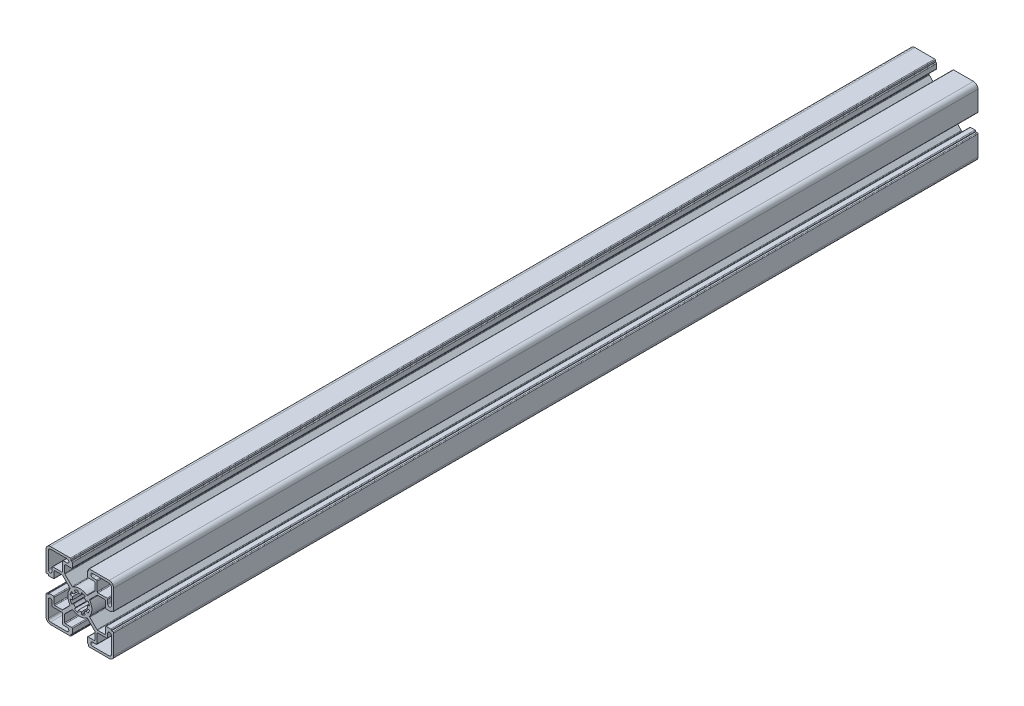
from build123d import *

# Parameters (mm, degrees)
BOSS_EXTRUDE1_DEPTH      = 152.4
BOSS_EXTRUDE1_DEPTH_BACK = 152.4
SKETCH3_R                = 5
FILLET1_R                = 0.5
CUT_EXTRUDE1_DEPTH       = 307.456424309
BOSS_EXTRUDE2_DEPTH      = 270.275


with BuildPart() as part:
    # Sketch3 → Boss-Extrude1 (new, two sides: drawn at the far end of the back side and taken through both)
    with BuildSketch(Plane.XY.offset(-BOSS_EXTRUDE1_DEPTH_BACK)):
        with BuildLine():
            Line((-11.55, -10.05), (-6.356915373, -4.856915373))
            ThreePointArc((-6.356915373, -4.856915373), (-8, 0), (-6.356915373, 4.856915373))
            Line((-6.356915373, 4.856915373), (-11.55, 10.05))
            Line((-11.55, 10.05), (-17.025, 10.05))
            Line((-17.025, 10.05), (-17.025, 5))
            Line((-17.025, 5), (-21, 5))
            Line((-21, 5), (-21, 5.8))
            Line((-21, 5.8), (-22.5, 5.8))
            Line((-22.5, 5.8), (-22.5, 19.5))
            ThreePointArc((-22.5, 19.5), (-21.621320344, 21.621320344), (-19.5, 22.5))
            Line((-19.5, 22.5), (-5.8, 22.5))
            Line((-5.8, 22.5), (-5.8, 21))
            Line((-5.8, 21), (-5, 21))
            Line((-5, 21), (-5, 17.025))
            Line((-5, 17.025), (-10.05, 17.025))
            Line((-10.05, 17.025), (-10.05, 11.55))
            Line((-10.05, 11.55), (-4.856915373, 6.356915373))
            ThreePointArc((-4.856915373, 6.356915373), (0, 8), (4.856915373, 6.356915373))
            Line((4.856915373, 6.356915373), (10.05, 11.55))
            Line((10.05, 11.55), (10.05, 17.025))
            Line((10.05, 17.025), (5, 17.025))
            Line((5, 17.025), (5, 21))
            Line((5, 21), (5.8, 21))
            Line((5.8, 21), (5.8, 22.5))
            Line((5.8, 22.5), (19.5, 22.5))
            ThreePointArc((19.5, 22.5), (21.621320344, 21.621320344), (22.5, 19.5))
            Line((22.5, 19.5), (22.5, 5.8))
            Line((22.5, 5.8), (21, 5.8))
            Line((21, 5.8), (21, 5))
            Line((21, 5), (17.025, 5))
            Line((17.025, 5), (17.025, 10.05))
            Line((17.025, 10.05), (11.55, 10.05))
            Line((11.55, 10.05), (6.356915373, 4.856915373))
            ThreePointArc((6.356915373, 4.856915373), (8, 0), (6.356915373, -4.856915373))
            Line((6.356915373, -4.856915373), (11.55, -10.05))
            Line((11.55, -10.05), (17.025, -10.05))
            Line((17.025, -10.05), (17.025, -5))
            Line((17.025, -5), (21, -5))
            Line((21, -5), (21, -5.8))
            Line((21, -5.8), (22.5, -5.8))
            Line((22.5, -5.8), (22.5, -19.5))
            ThreePointArc((22.5, -19.5), (21.621320344, -21.621320344), (19.5, -22.5))
            Line((19.5, -22.5), (5.8, -22.5))
            Line((5.8, -22.5), (5.8, -21))
            Line((5.8, -21), (5, -21))
            Line((5, -21), (5, -17.025))
            Line((5, -17.025), (10.05, -17.025))
            Line((10.05, -17.025), (10.05, -11.55))
            Line((10.05, -11.55), (4.856915373, -6.356915373))
            ThreePointArc((4.856915373, -6.356915373), (0, -8), (-4.856915373, -6.356915373))
            Line((-4.856915373, -6.356915373), (-10.05, -11.55))
            Line((-10.05, -11.55), (-10.05, -17.025))
            Line((-10.05, -17.025), (-5, -17.025))
            Line((-5, -17.025), (-5, -21))
            Line((-5, -21), (-5.8, -21))
            Line((-5.8, -21), (-5.8, -22.5))
            Line((-5.8, -22.5), (-19.5, -22.5))
            ThreePointArc((-19.5, -22.5), (-21.621320344, -21.621320344), (-22.5, -19.5))
            Line((-22.5, -19.5), (-22.5, -5.8))
            Line((-22.5, -5.8), (-21, -5.8))
            Line((-21, -5.8), (-21, -5))
            Line((-21, -5), (-17.025, -5))
            Line((-17.025, -5), (-17.025, -10.05))
            Line((-17.025, -10.05), (-11.55, -10.05))
        make_face()
        with Locations(Location((0, 0, 0), (0, 0, 180))):
            Circle(SKETCH3_R, mode=Mode.SUBTRACT)
        with BuildLine():
            Line((-21, 8.5375), (-21, 19.5))
            ThreePointArc((-21, 19.5), (-20.560660172, 20.560660172), (-19.5, 21))
            Line((-19.5, 21), (-8.5375, 21))
            ThreePointArc((-8.5375, 21), (-7.3, 19.7625), (-8.5375, 18.525))
            Line((-8.5375, 18.525), (-11.55, 18.525))
            Line((-11.55, 18.525), (-11.55, 11.55))
            Line((-11.55, 11.55), (-18.525, 11.55))
            Line((-18.525, 11.55), (-18.525, 8.5375))
            ThreePointArc((-18.525, 8.5375), (-19.7625, 7.3), (-21, 8.5375))
        make_face(mode=Mode.SUBTRACT)
        with BuildLine():
            Line((8.5375, 21), (19.5, 21))
            ThreePointArc((19.5, 21), (20.560660172, 20.560660172), (21, 19.5))
            Line((21, 19.5), (21, 8.5375))
            ThreePointArc((21, 8.5375), (19.7625, 7.3), (18.525, 8.5375))
            Line((18.525, 8.5375), (18.525, 11.55))
            Line((18.525, 11.55), (11.55, 11.55))
            Line((11.55, 11.55), (11.55, 18.525))
            Line((11.55, 18.525), (8.5375, 18.525))
            ThreePointArc((8.5375, 18.525), (7.3, 19.7625), (8.5375, 21))
        make_face(mode=Mode.SUBTRACT)
        with BuildLine():
            Line((21, -8.5375), (21, -19.5))
            ThreePointArc((21, -19.5), (20.560660172, -20.560660172), (19.5, -21))
            Line((19.5, -21), (8.5375, -21))
            ThreePointArc((8.5375, -21), (7.3, -19.7625), (8.5375, -18.525))
            Line((8.5375, -18.525), (11.55, -18.525))
            Line((11.55, -18.525), (11.55, -11.55))
            Line((11.55, -11.55), (18.525, -11.55))
            Line((18.525, -11.55), (18.525, -8.5375))
            ThreePointArc((18.525, -8.5375), (19.7625, -7.3), (21, -8.5375))
        make_face(mode=Mode.SUBTRACT)
        with BuildLine():
            Line((-8.5375, -21), (-19.5, -21))
            ThreePointArc((-19.5, -21), (-20.560660172, -20.560660172), (-21, -19.5))
            Line((-21, -19.5), (-21, -8.5375))
            ThreePointArc((-21, -8.5375), (-19.7625, -7.3), (-18.525, -8.5375))
            Line((-18.525, -8.5375), (-18.525, -11.55))
            Line((-18.525, -11.55), (-11.55, -11.55))
            Line((-11.55, -11.55), (-11.55, -18.525))
            Line((-11.55, -18.525), (-8.5375, -18.525))
            ThreePointArc((-8.5375, -18.525), (-7.3, -19.7625), (-8.5375, -21))
        make_face(mode=Mode.SUBTRACT)
    extrude(amount=BOSS_EXTRUDE1_DEPTH + BOSS_EXTRUDE1_DEPTH_BACK)

    # Fillet1
    fillet1_edges = [part.edges().sort_by_distance(p)[0] for p in [
        (-11.55, -18.525, 0),
        (-11.55, -11.55, 0),
        (18.525, -11.55, 0),
        (11.55, -11.55, 0),
        (11.55, -18.525, 0),
        (11.55, 18.525, 0),
        (11.55, 11.55, 0),
        (18.525, 11.55, 0),
        (-18.525, 11.55, 0),
        (-11.55, 11.55, 0),
        (-11.55, 18.525, 0),
        (6.356915373, -4.856915373, 0),
        (11.55, -10.05, 0),
        (17.025, -10.05, 0),
        (17.025, -5, 0),
        (21, -5, 0),
        (22.5, -5.8, 0),
        (5.8, -22.5, 0),
        (5, -21, 0),
        (5, -17.025, 0),
        (10.05, -17.025, 0),
        (10.05, -11.55, 0),
        (4.856915373, -6.356915373, 0),
        (-4.856915373, -6.356915373, 0),
        (-10.05, -11.55, 0),
        (-10.05, -17.025, 0),
        (-5, -17.025, 0),
        (-5, -21, 0),
        (-5.8, -22.5, 0),
        (-22.5, -5.8, 0),
        (-21, -5, 0),
        (-17.025, -5, 0),
        (-17.025, -10.05, 0),
        (-11.55, -10.05, 0),
        (-6.356915373, -4.856915373, 0),
        (-6.356915373, 4.856915373, 0),
        (-11.55, 10.05, 0),
        (-17.025, 10.05, 0),
        (-17.025, 5, 0),
        (-21, 5, 0),
        (-22.5, 5.8, 0),
        (-5.8, 22.5, 0),
        (-5, 21, 0),
        (-5, 17.025, 0),
        (-10.05, 17.025, 0),
        (-10.05, 11.55, 0),
        (-4.856915373, 6.356915373, 0),
        (4.856915373, 6.356915373, 0),
        (10.05, 11.55, 0),
        (10.05, 17.025, 0),
        (5, 17.025, 0),
        (5, 21, 0),
        (5.8, 22.5, 0),
        (22.5, 5.8, 0),
        (21, 5, 0),
        (17.025, 5, 0),
        (11.55, 10.05, 0),
        (6.356915373, 4.856915373, 0),
    ]]
    fillet(fillet1_edges, radius=FILLET1_R)

    # Sketch4 → Cut-Extrude1 (cut, through all)
    with BuildSketch(Plane.XY.offset(152.4)):
        with BuildLine():
            Line((-1.268087093, 6.375104323), (-0.97545161, 4.903926402))
            ThreePointArc((-0.97545161, 4.903926402), (-1.913417162, 4.619397663), (-2.777851165, 4.157348062))
            Line((-2.777851165, 4.157348062), (-3.611206515, 5.40455248))
            ThreePointArc((-3.611206515, 5.40455248), (-2.48744231, 6.005216961), (-1.268087093, 6.375104323))
        make_face()
        with BuildLine():
            Line((1.268087093, 6.375104323), (0.97545161, 4.903926402))
            ThreePointArc((0.97545161, 4.903926402), (1.913417162, 4.619397663), (2.777851165, 4.157348062))
            Line((2.777851165, 4.157348062), (3.611206515, 5.40455248))
            ThreePointArc((3.611206515, 5.40455248), (2.48744231, 6.005216961), (1.268087093, 6.375104323))
        make_face()
        with BuildLine():
            Line((5.40455248, 3.611206515), (4.157348062, 2.777851165))
            ThreePointArc((4.157348062, 2.777851165), (4.619397663, 1.913417162), (4.903926402, 0.97545161))
            Line((4.903926402, 0.97545161), (6.375104323, 1.268087093))
            ThreePointArc((6.375104323, 1.268087093), (6.005216961, 2.48744231), (5.40455248, 3.611206515))
        make_face()
        with BuildLine():
            Line((6.375104323, -1.268087093), (4.903926402, -0.97545161))
            ThreePointArc((4.903926402, -0.97545161), (4.619397663, -1.913417162), (4.157348062, -2.777851165))
            Line((4.157348062, -2.777851165), (5.40455248, -3.611206515))
            ThreePointArc((5.40455248, -3.611206515), (6.005216961, -2.48744231), (6.375104323, -1.268087093))
        make_face()
        with BuildLine():
            Line((3.611206515, -5.40455248), (2.777851165, -4.157348062))
            ThreePointArc((2.777851165, -4.157348062), (1.913417162, -4.619397663), (0.97545161, -4.903926402))
            Line((0.97545161, -4.903926402), (1.268087093, -6.375104323))
            ThreePointArc((1.268087093, -6.375104323), (2.48744231, -6.005216961), (3.611206515, -5.40455248))
        make_face()
        with BuildLine():
            Line((-1.268087093, -6.375104323), (-0.97545161, -4.903926402))
            ThreePointArc((-0.97545161, -4.903926402), (-1.913417162, -4.619397663), (-2.777851165, -4.157348062))
            Line((-2.777851165, -4.157348062), (-3.611206515, -5.40455248))
            ThreePointArc((-3.611206515, -5.40455248), (-2.48744231, -6.005216961), (-1.268087093, -6.375104323))
        make_face()
        with BuildLine():
            Line((-5.40455248, -3.611206515), (-4.157348062, -2.777851165))
            ThreePointArc((-4.157348062, -2.777851165), (-4.619397663, -1.913417162), (-4.903926402, -0.97545161))
            Line((-4.903926402, -0.97545161), (-6.375104323, -1.268087093))
            ThreePointArc((-6.375104323, -1.268087093), (-6.005216961, -2.48744231), (-5.40455248, -3.611206515))
        make_face()
        with BuildLine():
            Line((-6.375104323, 1.268087093), (-4.903926402, 0.97545161))
            ThreePointArc((-4.903926402, 0.97545161), (-4.619397663, 1.913417162), (-4.157348062, 2.777851165))
            Line((-4.157348062, 2.777851165), (-5.40455248, 3.611206515))
            ThreePointArc((-5.40455248, 3.611206515), (-6.005216961, 2.48744231), (-6.375104323, 1.268087093))
        make_face()
    extrude(amount=-CUT_EXTRUDE1_DEPTH, mode=Mode.SUBTRACT)

    # Sketch5 → Boss-Extrude2 (add)
    with BuildSketch(Plane.XY.offset(152.4)):
        with BuildLine():
            Line((22.5, -19.5), (22.5, -6.3))
            ThreePointArc((22.5, -6.3), (22.353553391, -5.946446609), (22, -5.8))
            Line((22, -5.8), (21, -5.8))
            Line((21, -5.8), (21, -5.5))
            ThreePointArc((21, -5.5), (20.853553391, -5.146446609), (20.5, -5))
            Line((20.5, -5), (17.525, -5))
            ThreePointArc((17.525, -5), (17.171446609, -5.146446609), (17.025, -5.5))
            Line((17.025, -5.5), (17.025, -9.55))
            ThreePointArc((17.025, -9.55), (16.878553391, -9.903553391), (16.525, -10.05))
            Line((16.525, -10.05), (11.757106781, -10.05))
            ThreePointArc((11.757106781, -10.05), (11.565765065, -10.011939766), (11.403553391, -9.903553391))
            Line((11.403553391, -9.903553391), (6.658229, -5.158229))
            ThreePointArc((6.658229, -5.158229), (6.513911961, -4.850773717), (6.599324603, -4.522047632))
            ThreePointArc((6.599324603, -4.522047632), (8, 0), (6.599324603, 4.522047632))
            ThreePointArc((6.599324603, 4.522047632), (6.513911961, 4.850773717), (6.658229, 5.158229))
            Line((6.658229, 5.158229), (11.403553391, 9.903553391))
            ThreePointArc((11.403553391, 9.903553391), (11.565765065, 10.011939766), (11.757106781, 10.05))
            Line((11.757106781, 10.05), (17.025, 10.05))
            Line((17.025, 10.05), (17.025, 5.5))
            ThreePointArc((17.025, 5.5), (17.171446609, 5.146446609), (17.525, 5))
            Line((17.525, 5), (20.5, 5))
            ThreePointArc((20.5, 5), (20.853553391, 5.146446609), (21, 5.5))
            Line((21, 5.5), (21, 5.8))
            Line((21, 5.8), (22, 5.8))
            ThreePointArc((22, 5.8), (22.353553391, 5.946446609), (22.5, 6.3))
            Line((22.5, 6.3), (22.5, 19.5))
            ThreePointArc((22.5, 19.5), (21.621320344, 21.621320344), (19.5, 22.5))
            Line((19.5, 22.5), (6.3, 22.5))
            ThreePointArc((6.3, 22.5), (5.946446609, 22.353553391), (5.8, 22))
            Line((5.8, 22), (5.8, 21))
            Line((5.8, 21), (5.5, 21))
            ThreePointArc((5.5, 21), (5.146446609, 20.853553391), (5, 20.5))
            Line((5, 20.5), (5, 17.525))
            ThreePointArc((5, 17.525), (5.146446609, 17.171446609), (5.5, 17.025))
            Line((5.5, 17.025), (9.55, 17.025))
            ThreePointArc((9.55, 17.025), (9.903553391, 16.878553391), (10.05, 16.525))
            Line((10.05, 16.525), (10.05, 11.757106781))
            ThreePointArc((10.05, 11.757106781), (10.011939766, 11.565765065), (9.903553391, 11.403553391))
            Line((9.903553391, 11.403553391), (5.158229, 6.658229))
            ThreePointArc((5.158229, 6.658229), (4.850773717, 6.513911961), (4.522047632, 6.599324603))
            ThreePointArc((4.522047632, 6.599324603), (0, 8), (-4.522047632, 6.599324603))
            ThreePointArc((-4.522047632, 6.599324603), (-4.850773717, 6.513911961), (-5.158229, 6.658229))
            Line((-5.158229, 6.658229), (-9.903553391, 11.403553391))
            ThreePointArc((-9.903553391, 11.403553391), (-10.011939766, 11.565765065), (-10.05, 11.757106781))
            Line((-10.05, 11.757106781), (-10.05, 16.525))
            ThreePointArc((-10.05, 16.525), (-9.903553391, 16.878553391), (-9.55, 17.025))
            Line((-9.55, 17.025), (-5.5, 17.025))
            ThreePointArc((-5.5, 17.025), (-5.146446609, 17.171446609), (-5, 17.525))
            Line((-5, 17.525), (-5, 20.5))
            ThreePointArc((-5, 20.5), (-5.146446609, 20.853553391), (-5.5, 21))
            Line((-5.5, 21), (-5.8, 21))
            Line((-5.8, 21), (-5.8, 22))
            ThreePointArc((-5.8, 22), (-5.946446609, 22.353553391), (-6.3, 22.5))
            Line((-6.3, 22.5), (-19.5, 22.5))
            ThreePointArc((-19.5, 22.5), (-21.621320344, 21.621320344), (-22.5, 19.5))
            Line((-22.5, 19.5), (-22.5, 6.3))
            ThreePointArc((-22.5, 6.3), (-22.353553391, 5.946446609), (-22, 5.8))
            Line((-22, 5.8), (-21, 5.8))
            Line((-21, 5.8), (-21, 5.5))
            ThreePointArc((-21, 5.5), (-20.853553391, 5.146446609), (-20.5, 5))
            Line((-20.5, 5), (-17.525, 5))
            ThreePointArc((-17.525, 5), (-17.171446609, 5.146446609), (-17.025, 5.5))
            Line((-17.025, 5.5), (-17.025, 9.55))
            ThreePointArc((-17.025, 9.55), (-16.878553391, 9.903553391), (-16.525, 10.05))
            Line((-16.525, 10.05), (-11.757106781, 10.05))
            ThreePointArc((-11.757106781, 10.05), (-11.565765065, 10.011939766), (-11.403553391, 9.903553391))
            Line((-11.403553391, 9.903553391), (-6.658229, 5.158229))
            ThreePointArc((-6.658229, 5.158229), (-6.513911961, 4.850773717), (-6.599324603, 4.522047632))
            ThreePointArc((-6.599324603, 4.522047632), (-8, 0), (-6.599324603, -4.522047632))
            ThreePointArc((-6.599324603, -4.522047632), (-6.513911961, -4.850773717), (-6.658229, -5.158229))
            Line((-6.658229, -5.158229), (-11.403553391, -9.903553391))
            ThreePointArc((-11.403553391, -9.903553391), (-11.565765065, -10.011939766), (-11.757106781, -10.05))
            Line((-11.757106781, -10.05), (-16.525, -10.05))
            ThreePointArc((-16.525, -10.05), (-16.878553391, -9.903553391), (-17.025, -9.55))
            Line((-17.025, -9.55), (-17.025, -5.5))
            ThreePointArc((-17.025, -5.5), (-17.171446609, -5.146446609), (-17.525, -5))
            Line((-17.525, -5), (-20.5, -5))
            ThreePointArc((-20.5, -5), (-20.853553391, -5.146446609), (-21, -5.5))
            Line((-21, -5.5), (-21, -5.8))
            Line((-21, -5.8), (-22, -5.8))
            ThreePointArc((-22, -5.8), (-22.353553391, -5.946446609), (-22.5, -6.3))
            Line((-22.5, -6.3), (-22.5, -19.5))
            ThreePointArc((-22.5, -19.5), (-21.621320344, -21.621320344), (-19.5, -22.5))
            Line((-19.5, -22.5), (-6.3, -22.5))
            ThreePointArc((-6.3, -22.5), (-5.946446609, -22.353553391), (-5.8, -22))
            Line((-5.8, -22), (-5.8, -21))
            Line((-5.8, -21), (-5.5, -21))
            ThreePointArc((-5.5, -21), (-5.146446609, -20.853553391), (-5, -20.5))
            Line((-5, -20.5), (-5, -17.525))
            ThreePointArc((-5, -17.525), (-5.146446609, -17.171446609), (-5.5, -17.025))
            Line((-5.5, -17.025), (-9.55, -17.025))
            ThreePointArc((-9.55, -17.025), (-9.903553391, -16.878553391), (-10.05, -16.525))
            Line((-10.05, -16.525), (-10.05, -11.757106781))
            ThreePointArc((-10.05, -11.757106781), (-10.011939766, -11.565765065), (-9.903553391, -11.403553391))
            Line((-9.903553391, -11.403553391), (-5.158229, -6.658229))
            ThreePointArc((-5.158229, -6.658229), (-4.850773717, -6.513911961), (-4.522047632, -6.599324603))
            ThreePointArc((-4.522047632, -6.599324603), (0, -8), (4.522047632, -6.599324603))
            ThreePointArc((4.522047632, -6.599324603), (4.850773717, -6.513911961), (5.158229, -6.658229))
            Line((5.158229, -6.658229), (9.903553391, -11.403553391))
            ThreePointArc((9.903553391, -11.403553391), (10.011939766, -11.565765065), (10.05, -11.757106781))
            Line((10.05, -11.757106781), (10.05, -16.525))
            ThreePointArc((10.05, -16.525), (9.903553391, -16.878553391), (9.55, -17.025))
            Line((9.55, -17.025), (5.5, -17.025))
            ThreePointArc((5.5, -17.025), (5.146446609, -17.171446609), (5, -17.525))
            Line((5, -17.525), (5, -20.5))
            ThreePointArc((5, -20.5), (5.146446609, -20.853553391), (5.5, -21))
            Line((5.5, -21), (5.8, -21))
            Line((5.8, -21), (5.8, -22))
            ThreePointArc((5.8, -22), (5.946446609, -22.353553391), (6.3, -22.5))
            Line((6.3, -22.5), (19.5, -22.5))
            ThreePointArc((19.5, -22.5), (21.621320344, -21.621320344), (22.5, -19.5))
        make_face()
        with BuildLine():
            Line((-11.55, -18.025), (-11.55, -12.05))
            ThreePointArc((-11.55, -12.05), (-11.696446609, -11.696446609), (-12.05, -11.55))
            Line((-12.05, -11.55), (-18.525, -11.55))
            Line((-18.525, -11.55), (-18.525, -8.5375))
            ThreePointArc((-18.525, -8.5375), (-19.7625, -7.3), (-21, -8.5375))
            Line((-21, -8.5375), (-21, -19.5))
            ThreePointArc((-21, -19.5), (-20.560660172, -20.560660172), (-19.5, -21))
            Line((-19.5, -21), (-8.5375, -21))
            ThreePointArc((-8.5375, -21), (-7.3, -19.7625), (-8.5375, -18.525))
            Line((-8.5375, -18.525), (-11.05, -18.525))
            ThreePointArc((-11.05, -18.525), (-11.403553391, -18.378553391), (-11.55, -18.025))
        make_face(mode=Mode.SUBTRACT)
        with BuildLine():
            Line((-0.97545161, 4.903926402), (-1.268087093, 6.375104323))
            ThreePointArc((-1.268087093, 6.375104323), (-2.48744231, 6.005216961), (-3.611206515, 5.40455248))
            Line((-3.611206515, 5.40455248), (-2.777851165, 4.157348062))
            ThreePointArc((-2.777851165, 4.157348062), (-3.535533906, 3.535533906), (-4.157348062, 2.777851165))
            Line((-4.157348062, 2.777851165), (-5.40455248, 3.611206515))
            ThreePointArc((-5.40455248, 3.611206515), (-6.005216961, 2.48744231), (-6.375104323, 1.268087093))
            Line((-6.375104323, 1.268087093), (-4.903926402, 0.97545161))
            ThreePointArc((-4.903926402, 0.97545161), (-5, 0), (-4.903926402, -0.97545161))
            Line((-4.903926402, -0.97545161), (-6.375104323, -1.268087093))
            ThreePointArc((-6.375104323, -1.268087093), (-6.005216961, -2.48744231), (-5.40455248, -3.611206515))
            Line((-5.40455248, -3.611206515), (-4.157348062, -2.777851165))
            ThreePointArc((-4.157348062, -2.777851165), (-3.535533906, -3.535533906), (-2.777851165, -4.157348062))
            Line((-2.777851165, -4.157348062), (-3.611206515, -5.40455248))
            ThreePointArc((-3.611206515, -5.40455248), (-2.48744231, -6.005216961), (-1.268087093, -6.375104323))
            Line((-1.268087093, -6.375104323), (-0.97545161, -4.903926402))
            ThreePointArc((-0.97545161, -4.903926402), (0, -5), (0.97545161, -4.903926402))
            Line((0.97545161, -4.903926402), (1.268087093, -6.375104323))
            ThreePointArc((1.268087093, -6.375104323), (2.48744231, -6.005216961), (3.611206515, -5.40455248))
            Line((3.611206515, -5.40455248), (2.777851165, -4.157348062))
            ThreePointArc((2.777851165, -4.157348062), (3.535533906, -3.535533906), (4.157348062, -2.777851165))
            Line((4.157348062, -2.777851165), (5.40455248, -3.611206515))
            ThreePointArc((5.40455248, -3.611206515), (6.005216961, -2.48744231), (6.375104323, -1.268087093))
            Line((6.375104323, -1.268087093), (4.903926402, -0.97545161))
            ThreePointArc((4.903926402, -0.97545161), (5, 0), (4.903926402, 0.97545161))
            Line((4.903926402, 0.97545161), (6.375104323, 1.268087093))
            ThreePointArc((6.375104323, 1.268087093), (6.005216961, 2.48744231), (5.40455248, 3.611206515))
            Line((5.40455248, 3.611206515), (4.157348062, 2.777851165))
            ThreePointArc((4.157348062, 2.777851165), (3.535533906, 3.535533906), (2.777851165, 4.157348062))
            Line((2.777851165, 4.157348062), (3.611206515, 5.40455248))
            ThreePointArc((3.611206515, 5.40455248), (2.48744231, 6.005216961), (1.268087093, 6.375104323))
            Line((1.268087093, 6.375104323), (0.97545161, 4.903926402))
            ThreePointArc((0.97545161, 4.903926402), (0, 5), (-0.97545161, 4.903926402))
        make_face(mode=Mode.SUBTRACT)
        with BuildLine():
            Line((18.025, -11.55), (12.05, -11.55))
            ThreePointArc((12.05, -11.55), (11.696446609, -11.696446609), (11.55, -12.05))
            Line((11.55, -12.05), (11.55, -18.025))
            ThreePointArc((11.55, -18.025), (11.403553391, -18.378553391), (11.05, -18.525))
            Line((11.05, -18.525), (8.5375, -18.525))
            ThreePointArc((8.5375, -18.525), (7.3, -19.7625), (8.5375, -21))
            Line((8.5375, -21), (19.5, -21))
            ThreePointArc((19.5, -21), (20.560660172, -20.560660172), (21, -19.5))
            Line((21, -19.5), (21, -8.5375))
            ThreePointArc((21, -8.5375), (19.7625, -7.3), (18.525, -8.5375))
            Line((18.525, -8.5375), (18.525, -11.05))
            ThreePointArc((18.525, -11.05), (18.378553391, -11.403553391), (18.025, -11.55))
        make_face(mode=Mode.SUBTRACT)
        with BuildLine():
            Line((11.55, 18.025), (11.55, 12.05))
            ThreePointArc((11.55, 12.05), (11.696446609, 11.696446609), (12.05, 11.55))
            Line((12.05, 11.55), (18.025, 11.55))
            ThreePointArc((18.025, 11.55), (18.378553391, 11.403553391), (18.525, 11.05))
            Line((18.525, 11.05), (18.525, 8.5375))
            ThreePointArc((18.525, 8.5375), (19.7625, 7.3), (21, 8.5375))
            Line((21, 8.5375), (21, 19.5))
            ThreePointArc((21, 19.5), (20.560660172, 20.560660172), (19.5, 21))
            Line((19.5, 21), (8.5375, 21))
            ThreePointArc((8.5375, 21), (7.3, 19.7625), (8.5375, 18.525))
            Line((8.5375, 18.525), (11.05, 18.525))
            ThreePointArc((11.05, 18.525), (11.403553391, 18.378553391), (11.55, 18.025))
        make_face(mode=Mode.SUBTRACT)
        with BuildLine():
            Line((-18.025, 11.55), (-12.05, 11.55))
            ThreePointArc((-12.05, 11.55), (-11.696446609, 11.696446609), (-11.55, 12.05))
            Line((-11.55, 12.05), (-11.55, 18.025))
            ThreePointArc((-11.55, 18.025), (-11.403553391, 18.378553391), (-11.05, 18.525))
            Line((-11.05, 18.525), (-8.5375, 18.525))
            ThreePointArc((-8.5375, 18.525), (-7.3, 19.7625), (-8.5375, 21))
            Line((-8.5375, 21), (-19.5, 21))
            ThreePointArc((-19.5, 21), (-20.560660172, 20.560660172), (-21, 19.5))
            Line((-21, 19.5), (-21, 8.5375))
            ThreePointArc((-21, 8.5375), (-19.7625, 7.3), (-18.525, 8.5375))
            Line((-18.525, 8.5375), (-18.525, 11.05))
            ThreePointArc((-18.525, 11.05), (-18.378553391, 11.403553391), (-18.025, 11.55))
        make_face(mode=Mode.SUBTRACT)
    extrude(amount=BOSS_EXTRUDE2_DEPTH)


solid = part.part
